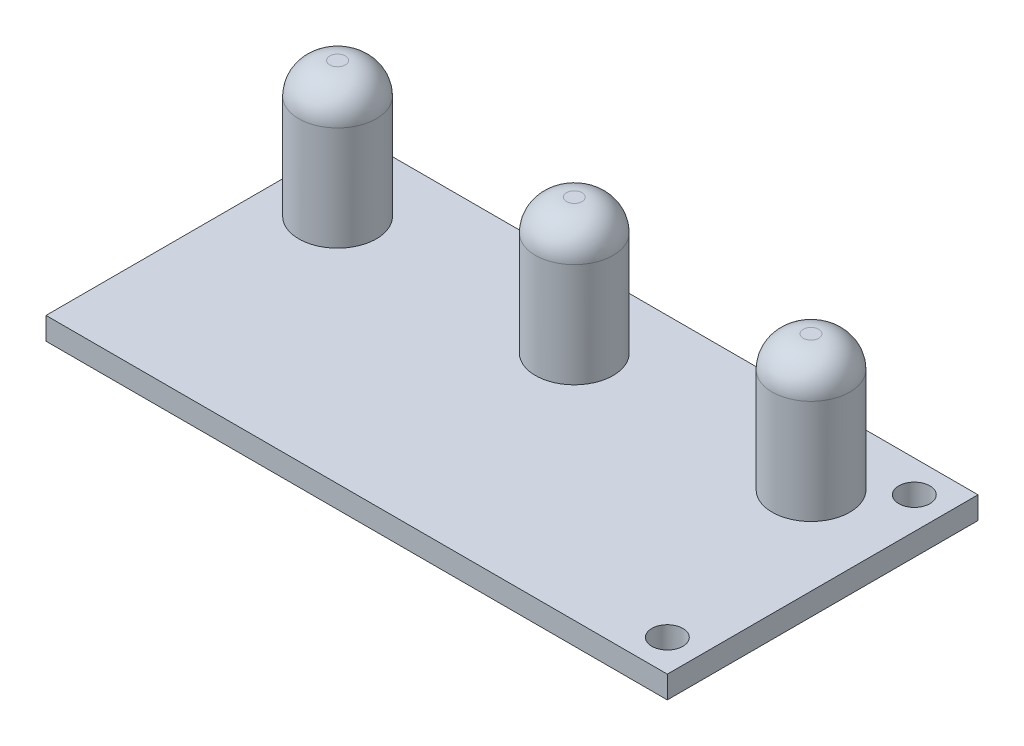
from build123d import *

# Parameters (mm, degrees)
SKETCH1_W           = 40
SKETCH1_H           = 20
BOSS_EXTRUDE1_DEPTH = 1.44
SKETCH2_R           = 2.5
BOSS_EXTRUDE2_DEPTH = 8.7
FILLET1_R           = 2
SKETCH3_R           = 1
CUT_EXTRUDE1_DEPTH  = 24.993540797


with BuildPart() as part:
    # Sketch1 → Boss-Extrude1 (new body)
    with BuildSketch(Plane(origin=(0, 0, 0), x_dir=(1, 0, 0), z_dir=(0, 1, 0))):
        Rectangle(SKETCH1_W, SKETCH1_H)
    extrude(amount=BOSS_EXTRUDE1_DEPTH)

    # Sketch2 → Boss-Extrude2 (add)
    with BuildSketch(Plane(origin=(0, 1.44, 0), x_dir=(1, 0, 0), z_dir=(0, 1, 0))):
        with Locations(Location((14.35, 4.9, 0), (0, 0, 90))):
            Circle(SKETCH2_R)
        with Locations(Location((-0.89, 4.9, 0), (0, 0, 90))):
            Circle(SKETCH2_R)
        with Locations(Location((-16.13, 4.9, 0), (0, 0, 90))):
            Circle(SKETCH2_R)
    extrude(amount=BOSS_EXTRUDE2_DEPTH)

    # Fillet1
    fillet1_edges = [part.edges().sort_by_distance(p)[0] for p in [
        (14.35, 10.14, -2.4),
        (-0.89, 10.14, -2.4),
        (-16.13, 10.14, -2.4),
    ]]
    fillet(fillet1_edges, radius=FILLET1_R)

    # Sketch3 → Cut-Extrude1 (cut, through all)
    with BuildSketch(Plane(origin=(0, 1.44, 0), x_dir=(1, 0, 0), z_dir=(0, 1, 0))):
        with Locations(Location((17.95, 7.95, 0), (0, 0, 270))):
            Circle(SKETCH3_R)
        with Locations(Location((17.95, -7.95, 0), (0, 0, 270))):
            Circle(SKETCH3_R)
    extrude(amount=-CUT_EXTRUDE1_DEPTH, mode=Mode.SUBTRACT)


solid = part.part
